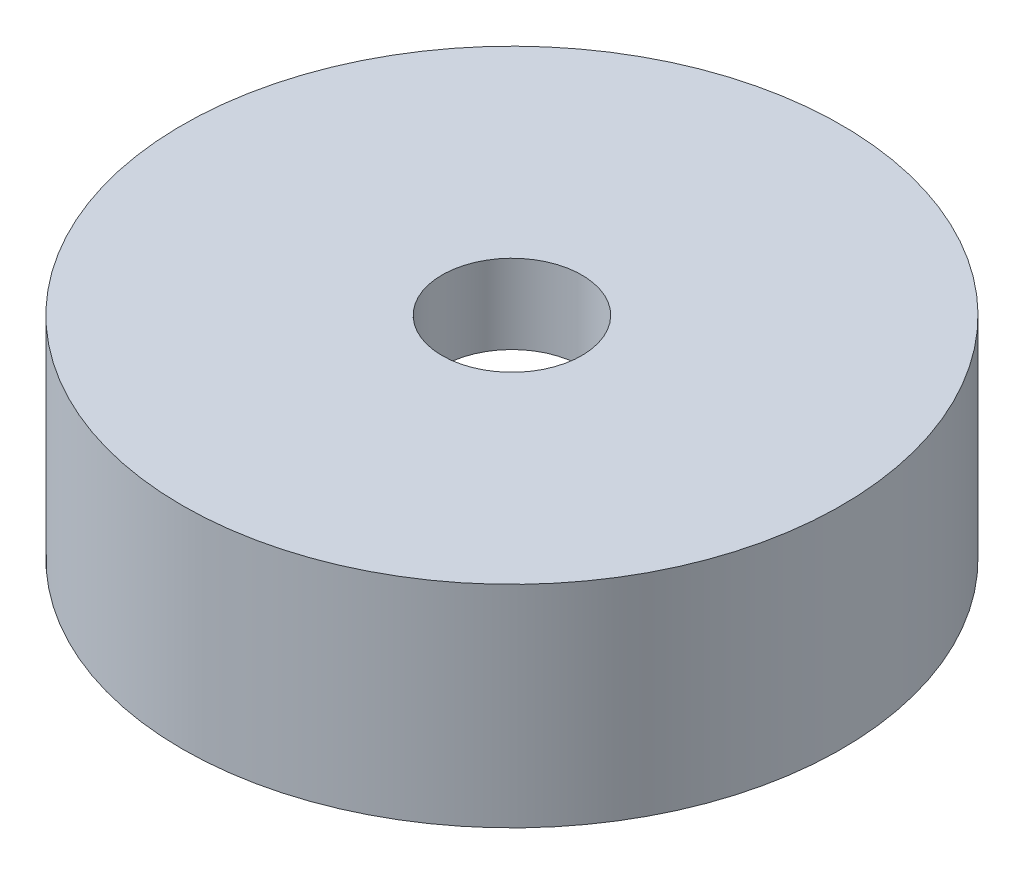
from build123d import *

# Parameters (mm, degrees)
SKETCH1_R           = 12.5
SKETCH1_R_2         = 10
BOSS_EXTRUDE1_DEPTH = 5
SKETCH2_R           = 12.5
SKETCH2_R_2         = 2.65
BOSS_EXTRUDE2_DEPTH = 3


with BuildPart() as part:
    # Sketch1 → Boss-Extrude1 (new body)
    with BuildSketch(Plane(origin=(0, 0, 0), x_dir=(1, 0, 0), z_dir=(0, 1, 0))):
        with Locations(Location((0, 0, 0), (0, 0, 270))):
            Circle(SKETCH1_R)
        with Locations(Location((0, 0, 0), (0, 0, 270))):
            Circle(SKETCH1_R_2, mode=Mode.SUBTRACT)
    extrude(amount=BOSS_EXTRUDE1_DEPTH)

    # Sketch2 → Boss-Extrude2 (add)
    with BuildSketch(Plane(origin=(0, 5, 0), x_dir=(1, 0, 0), z_dir=(0, 1, 0))):
        with Locations(Location((0, 0, 0), (0, 0, 270))):
            Circle(SKETCH2_R)
        with Locations(Location((0, 0, 0), (0, 0, 270))):
            Circle(SKETCH2_R_2, mode=Mode.SUBTRACT)
    extrude(amount=BOSS_EXTRUDE2_DEPTH)


solid = part.part
